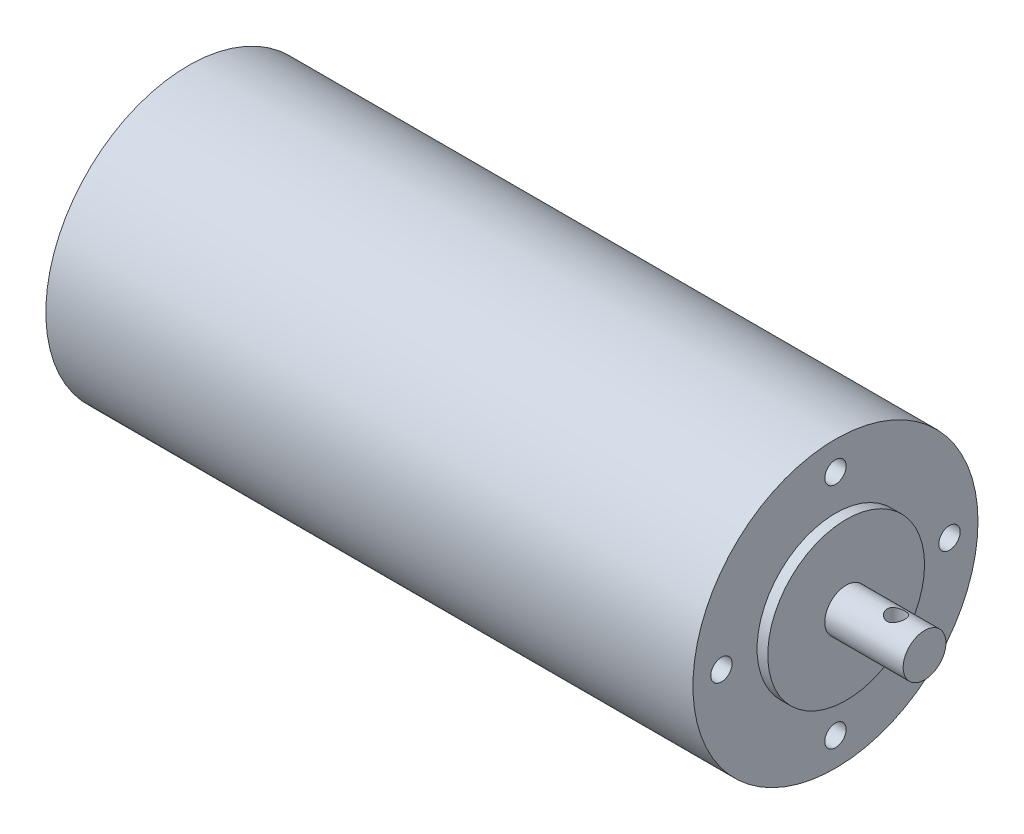
from build123d import *

# Parameters (mm, degrees)
SKETCH1_R               = 20
BOSS_EXTRUDE1_DEPTH     = 90.8
SKETCH2_R               = 11
BOSS_EXTRUDE2_DEPTH     = 1.5
SKETCH3_R               = 1.5
CUT_EXTRUDE1_DEPTH      = 3.2
SKETCH4_R               = 6.5
CUT_EXTRUDE2_DEPTH      = 5
SKETCH5_R               = 3
BOSS_EXTRUDE3_DEPTH     = 16
CUT_EXTRUDE3_DEPTH      = 10
CUT_EXTRUDE3_DEPTH_BACK = 10
SKETCH6_R               = 1.25
BOSS_EXTRUDE4_START     = 5
SKETCH7_R               = 6.5
BOSS_EXTRUDE4_DEPTH     = 5


with BuildPart() as part:
    # Sketch1 → Boss-Extrude1 (new body)
    with BuildSketch(Plane(origin=(0, 0, 0), x_dir=(0, 0, -1), z_dir=(1, 0, 0))):
        Circle(SKETCH1_R)
    extrude(amount=BOSS_EXTRUDE1_DEPTH)

    # Sketch2 → Boss-Extrude2 (add)
    with BuildSketch(Plane(origin=(90.8, 0, 0), x_dir=(0, 0, -1), z_dir=(1, 0, 0))):
        Circle(SKETCH2_R)
    extrude(amount=BOSS_EXTRUDE2_DEPTH)

    # Sketch3 → Cut-Extrude1 (cut)
    with BuildSketch(Plane(origin=(90.8, 0, 0), x_dir=(0, 0, -1), z_dir=(1, 0, 0))):
        with Locations((0, 16)):
            Circle(SKETCH3_R)
        with Locations((16, 0)):
            Circle(SKETCH3_R)
        with Locations((0, -16)):
            Circle(SKETCH3_R)
        with Locations((-16, 0)):
            Circle(SKETCH3_R)
    extrude(amount=-CUT_EXTRUDE1_DEPTH, mode=Mode.SUBTRACT)

    # Sketch4 → Cut-Extrude2 (cut)
    with BuildSketch(Plane(origin=(92.3, 0, 0), x_dir=(0, 0, -1), z_dir=(1, 0, 0))):
        Circle(SKETCH4_R)
    extrude(amount=-CUT_EXTRUDE2_DEPTH, mode=Mode.SUBTRACT)

    # Sketch5 → Boss-Extrude3 (add)
    with BuildSketch(Plane(origin=(87.3, 0, 0), x_dir=(0, 0, -1), z_dir=(1, 0, 0))):
        Circle(SKETCH5_R)
    extrude(amount=BOSS_EXTRUDE3_DEPTH)

    # Sketch6 → Cut-Extrude3 (cut, two sides: drawn at the far end of the back side and taken through both)
    with BuildSketch(Plane(origin=(0, 0, 0), x_dir=(1, 0, 0), z_dir=(0, 1, 0)).offset(-CUT_EXTRUDE3_DEPTH_BACK)):
        with Locations(Location((99.3, 0, 0), (0, 0, 90))):
            Circle(SKETCH6_R)
    extrude(amount=CUT_EXTRUDE3_DEPTH + CUT_EXTRUDE3_DEPTH_BACK, mode=Mode.SUBTRACT)

    # Sketch7 → Boss-Extrude4 (add)
    with BuildSketch(Plane(origin=(87.3, 0, 0), x_dir=(0, 0, -1), z_dir=(1, 0, 0)).offset(BOSS_EXTRUDE4_START)):
        Circle(SKETCH7_R)
    extrude(amount=-BOSS_EXTRUDE4_DEPTH)


solid = part.part
